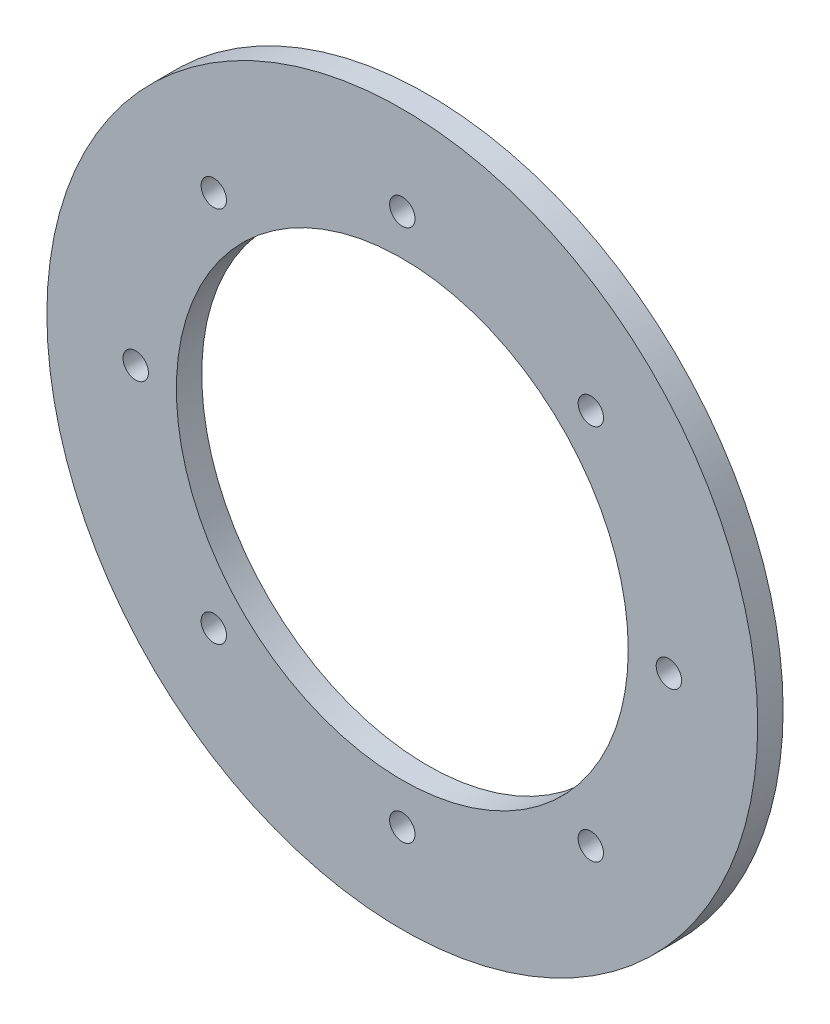
from build123d import *

# Parameters (mm, degrees)
SKETCH1_R           = 70
SKETCH1_R_2         = 44.5
SKETCH1_R_3         = 2.5
BOSS_EXTRUDE1_DEPTH = 5


with BuildPart() as part:
    # Sketch1 → Boss-Extrude1 (new body)
    with BuildSketch(Plane.XY):
        Circle(SKETCH1_R)
        Circle(SKETCH1_R_2, mode=Mode.SUBTRACT)
        with Locations((37.123106012, -37.123106012)):
            Circle(SKETCH1_R_3, mode=Mode.SUBTRACT)
        with Locations((52.5, 0)):
            Circle(SKETCH1_R_3, mode=Mode.SUBTRACT)
        with Locations((0, -52.5)):
            Circle(SKETCH1_R_3, mode=Mode.SUBTRACT)
        with Locations((-37.123106012, -37.123106012)):
            Circle(SKETCH1_R_3, mode=Mode.SUBTRACT)
        with Locations((-52.5, 0)):
            Circle(SKETCH1_R_3, mode=Mode.SUBTRACT)
        with Locations((37.123106012, 37.123106012)):
            Circle(SKETCH1_R_3, mode=Mode.SUBTRACT)
        with Locations((-37.123106012, 37.123106012)):
            Circle(SKETCH1_R_3, mode=Mode.SUBTRACT)
        with Locations((0, 52.5)):
            Circle(SKETCH1_R_3, mode=Mode.SUBTRACT)
    extrude(amount=BOSS_EXTRUDE1_DEPTH)


solid = part.part
